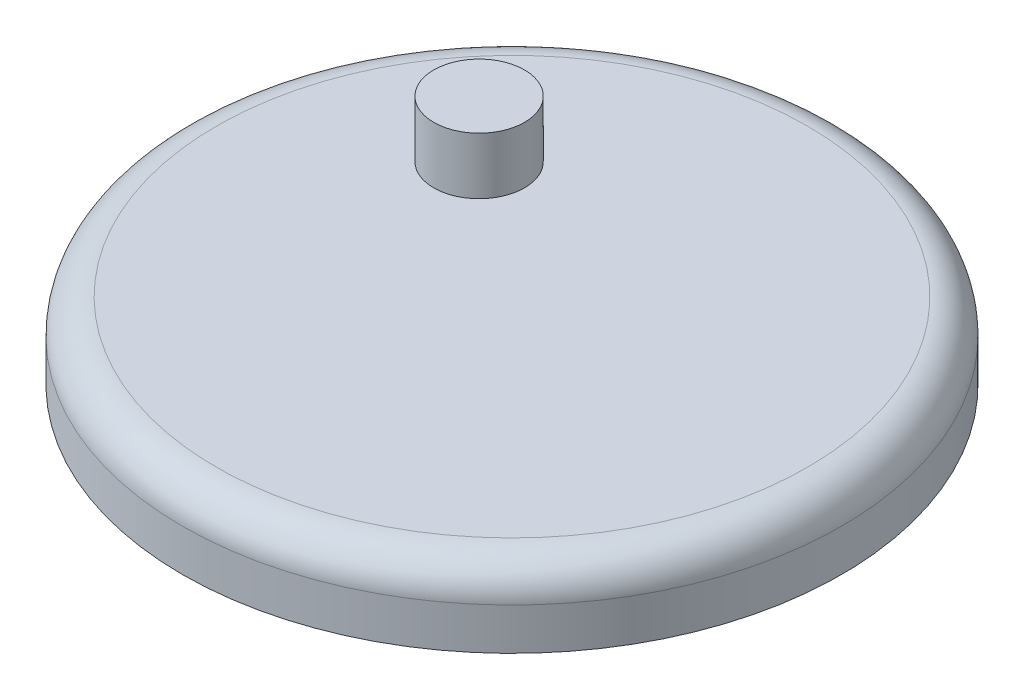
from build123d import *

# Parameters (mm, degrees)
SKETCH_1_W      = 29.03316099
SKETCH_1_H      = 6.688317385
FILLET_1_R      = 3
SKETCH_2_R      = 4
EXTRUDE_1_DEPTH = 5
SHELL_1_T       = -2


with BuildPart() as part:
    # 草图1 → 旋转1 (revolve)
    with BuildSketch(Plane.XY, mode=Mode.PRIVATE) as revolve_1_sk:
        with Locations((14.516580495, 3.344158693)):
            Rectangle(SKETCH_1_W, SKETCH_1_H)
    revolve(revolve_1_sk.sketch.rotate(Axis((0, 6.688317385, 0), (0, -1, 0)), 90), axis=Axis((0, 6.688317385, 0), (0, -1, 0)))

    # 圆角1
    fillet_1_edges = [part.edges().sort_by_distance(p)[0] for p in [
        (0, 6.688317385, -29.03316099),
    ]]
    fillet(fillet_1_edges, radius=FILLET_1_R)

    # 草图2 → 凸台-拉伸1 (add)
    with BuildSketch(Plane(origin=(0, 6.688317385, 0), x_dir=(1, 0, 0), z_dir=(0, 1, 0))):
        with Locations(Location((-11.747239152, 8.851672142, 0), (0, 0, 90))):
            Circle(SKETCH_2_R)
    extrude(amount=EXTRUDE_1_DEPTH)

    # 抽壳1
    shell_1_openings = [part.faces().sort_by_distance(p)[0] for p in [
        (0, 0, 0),
    ]]
    offset(amount=SHELL_1_T, openings=shell_1_openings, kind=Kind.INTERSECTION)


solid = part.part
